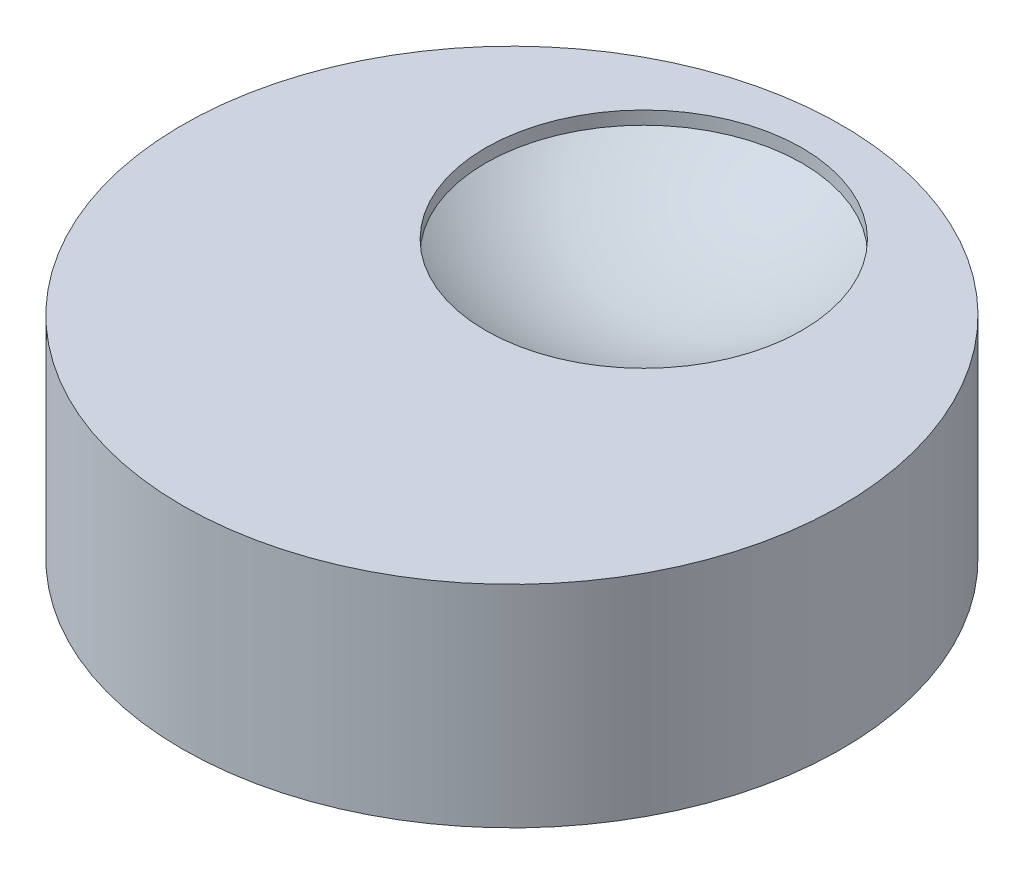
from build123d import *

# Parameters (mm, degrees)
SKETCH1_R           = 12.5
BOSS_EXTRUDE1_DEPTH = 8
BOSS_EXTRUDE2_START = -3
SKETCH2_R           = 12.5
BOSS_EXTRUDE2_DEPTH = 3
SKETCH3_R           = 6
CUT_EXTRUDE1_DEPTH  = 0.5
DOME1_FACE_RADIUS   = 6
DOME1_HEIGHT        = 2


with BuildPart() as part:
    # Sketch1 → Boss-Extrude1 (new body)
    with BuildSketch(Plane(origin=(0, 0, 0), x_dir=(1, 0, 0), z_dir=(0, 1, 0))):
        with Locations(Location((0, 0, 0), (0, 0, 270))):
            Circle(SKETCH1_R)
        with BuildLine():
            Line((-2.858321186, -1.2), (2.858321186, -1.2))
            ThreePointArc((2.858321186, -1.2), (0, 3.1), (-2.858321186, -1.2))
        make_face(mode=Mode.SUBTRACT)
    extrude(amount=BOSS_EXTRUDE1_DEPTH)

    # Sketch2 → Boss-Extrude2 (add)
    with BuildSketch(Plane(origin=(0, 8, 0), x_dir=(1, 0, 0), z_dir=(0, 1, 0)).offset(BOSS_EXTRUDE2_START)):
        with Locations(Location((0, 0, 0), (0, 0, 270))):
            Circle(SKETCH2_R)
    extrude(amount=BOSS_EXTRUDE2_DEPTH)

    # Sketch3 → Cut-Extrude1 (cut)
    with BuildSketch(Plane(origin=(0, 8, 0), x_dir=(1, 0, 0), z_dir=(0, 1, 0))):
        with Locations(Location((0, 5, 0), (0, 0, 270))):
            Circle(SKETCH3_R)
    extrude(amount=-CUT_EXTRUDE1_DEPTH, mode=Mode.SUBTRACT)

    # Dome1: a dome of height H over a round flat face of radius A is a cap of a sphere of radius (A * A + H * H) / (2 * H)
    dome1_r = (DOME1_FACE_RADIUS * DOME1_FACE_RADIUS + DOME1_HEIGHT * DOME1_HEIGHT) / (2 * DOME1_HEIGHT)
    dome1_base = Plane((0, 7.5, -5), z_dir=(0, -1, 0))
    with Locations(dome1_base.offset(DOME1_HEIGHT - dome1_r)):
        dome1_ball = Sphere(dome1_r, mode=Mode.PRIVATE)
    add(split(dome1_ball, bisect_by=dome1_base, keep=Keep.TOP, mode=Mode.PRIVATE), mode=Mode.SUBTRACT)


solid = part.part
